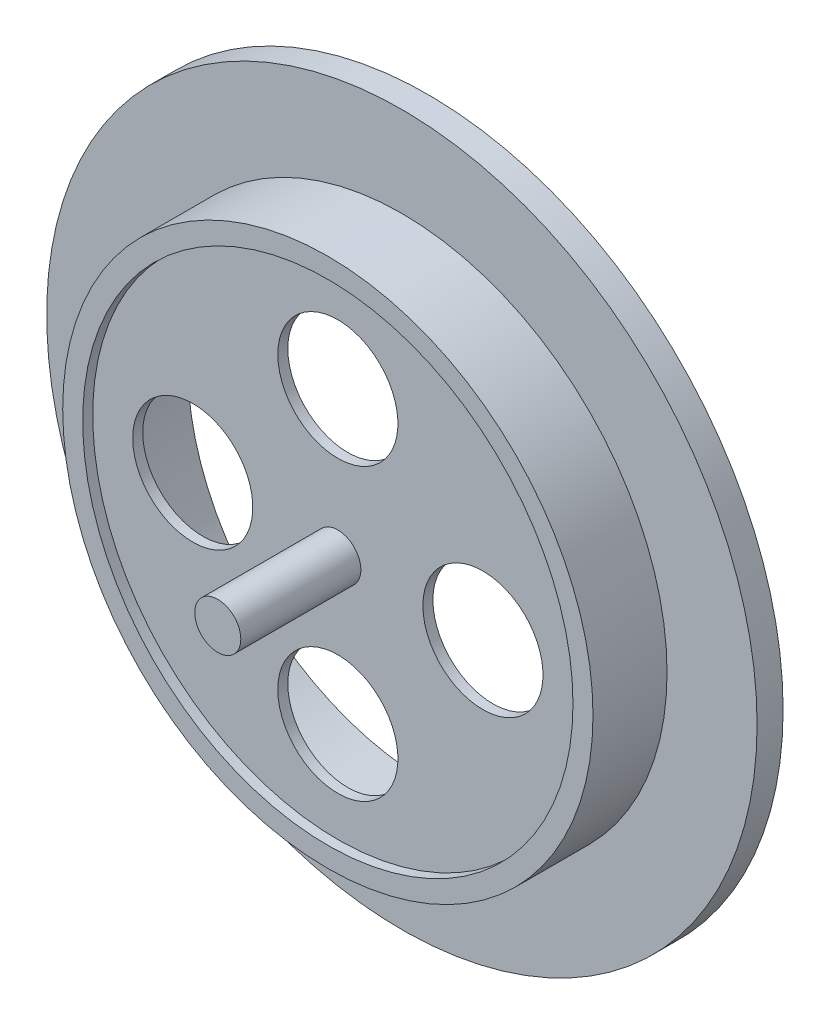
from build123d import *

# Parameters (mm, degrees)
SKETCH1_R           = 17.75
BOSS_EXTRUDE1_DEPTH = 1.3
SKETCH2_R           = 13.25
BOSS_EXTRUDE2_DEPTH = 3.7
SKETCH3_R           = 12
CUT_EXTRUDE1_DEPTH  = 4
SKETCH4_R           = 12.25
CUT_EXTRUDE2_DEPTH  = 0.5
SKETCH5_R           = 3
CUT_EXTRUDE3_DEPTH  = 0.5
SKETCH6_R           = 1.15
BOSS_EXTRUDE3_DEPTH = 6


with BuildPart() as part:
    # Sketch1 → Boss-Extrude1 (new body)
    with BuildSketch(Plane.XY):
        Circle(SKETCH1_R)
    extrude(amount=BOSS_EXTRUDE1_DEPTH)

    # Sketch2 → Boss-Extrude2 (add)
    with BuildSketch(Plane.XY.offset(1.3)):
        Circle(SKETCH2_R)
    extrude(amount=BOSS_EXTRUDE2_DEPTH)

    # Sketch3 → Cut-Extrude1 (cut)
    with BuildSketch(Plane(origin=(0, 0, 0), x_dir=(-1, 0, 0), z_dir=(0, 0, -1))):
        Circle(SKETCH3_R)
    extrude(amount=-CUT_EXTRUDE1_DEPTH, mode=Mode.SUBTRACT)

    # Sketch4 → Cut-Extrude2 (cut)
    with BuildSketch(Plane.XY.offset(5)):
        Circle(SKETCH4_R)
    extrude(amount=-CUT_EXTRUDE2_DEPTH, mode=Mode.SUBTRACT)

    # Sketch5 → Cut-Extrude3 (cut)
    with BuildSketch(Plane(origin=(0, 0, 4), x_dir=(-1, 0, 0), z_dir=(0, 0, -1))):
        with Locations((0, 7.25)):
            Circle(SKETCH5_R)
        with Locations((7.25, 0)):
            Circle(SKETCH5_R)
        with Locations((0, -7.25)):
            Circle(SKETCH5_R)
        with Locations((-7.25, 0)):
            Circle(SKETCH5_R)
    extrude(amount=-CUT_EXTRUDE3_DEPTH, mode=Mode.SUBTRACT)

    # Sketch6 → Boss-Extrude3 (add)
    with BuildSketch(Plane.XY.offset(4.5)):
        Circle(SKETCH6_R)
    extrude(amount=BOSS_EXTRUDE3_DEPTH)


solid = part.part
